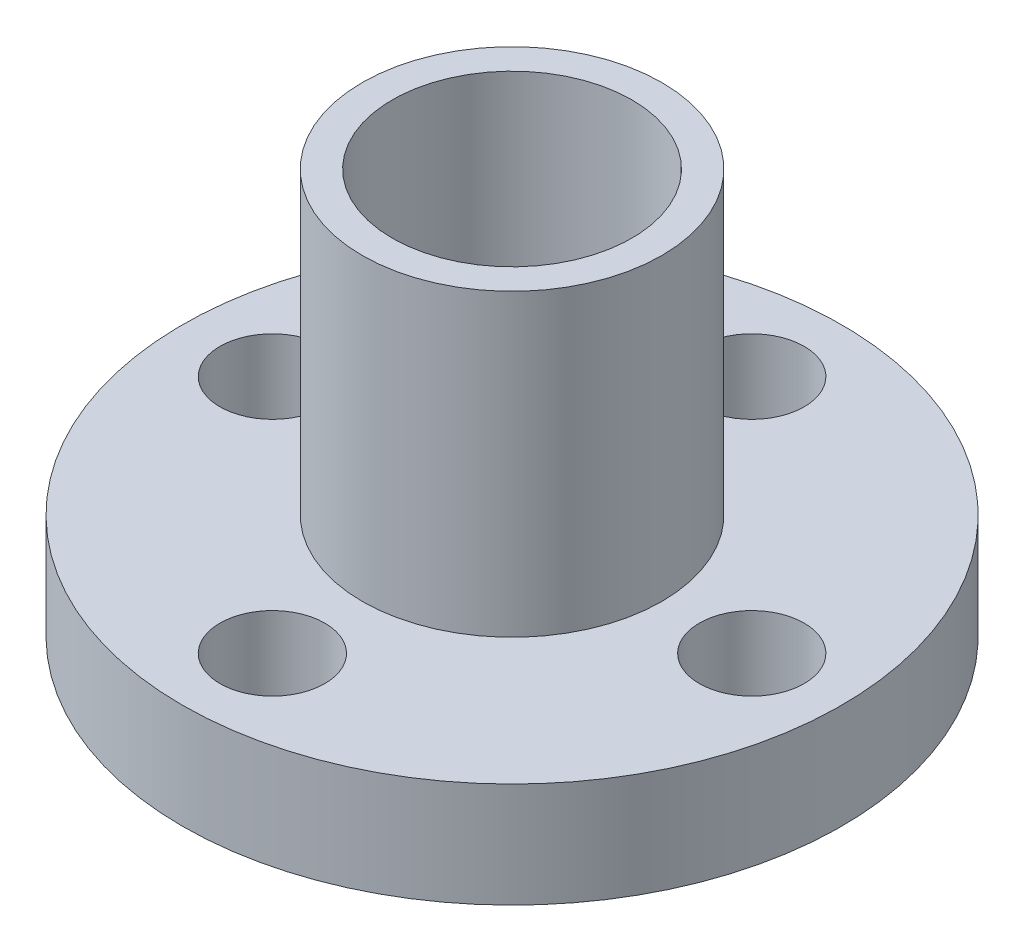
from build123d import *

# Parameters (mm, degrees)
SKETCH2_R          = 1.75
CUT_EXTRUDE1_DEPTH = 23.983689869


with BuildPart() as part:
    # Sketch1 → Revolve1 (revolve)
    with BuildSketch(Plane(origin=(0, 0, 0), x_dir=(0, 0, -1), z_dir=(1, 0, 0)), mode=Mode.PRIVATE) as revolve1_sk:
        Polygon((1, 15), (0, 15), (0, 0), (1, 0), (1, 1.5), (7, 1.5), (7, 5), (1, 5), align=None)
    revolve(revolve1_sk.sketch.rotate(Axis((0, 15, 4), (0, -1, 0)), 180), axis=Axis((0, 15, 4), (0, -1, 0)))

    # Sketch2 → Cut-Extrude1 (cut, through all)
    with BuildSketch(Plane.XZ.offset(-1.5)):
        with Locations(Location((0, -4, 0), (0, 0, 270))):
            Circle(SKETCH2_R)
        with Locations(Location((-8, 4, 0), (0, 0, 270))):
            Circle(SKETCH2_R)
        with Locations(Location((0, 12, 0), (0, 0, 270))):
            Circle(SKETCH2_R)
        with Locations(Location((8, 4, 0), (0, 0, 270))):
            Circle(SKETCH2_R)
    extrude(amount=-CUT_EXTRUDE1_DEPTH, mode=Mode.SUBTRACT)


solid = part.part
